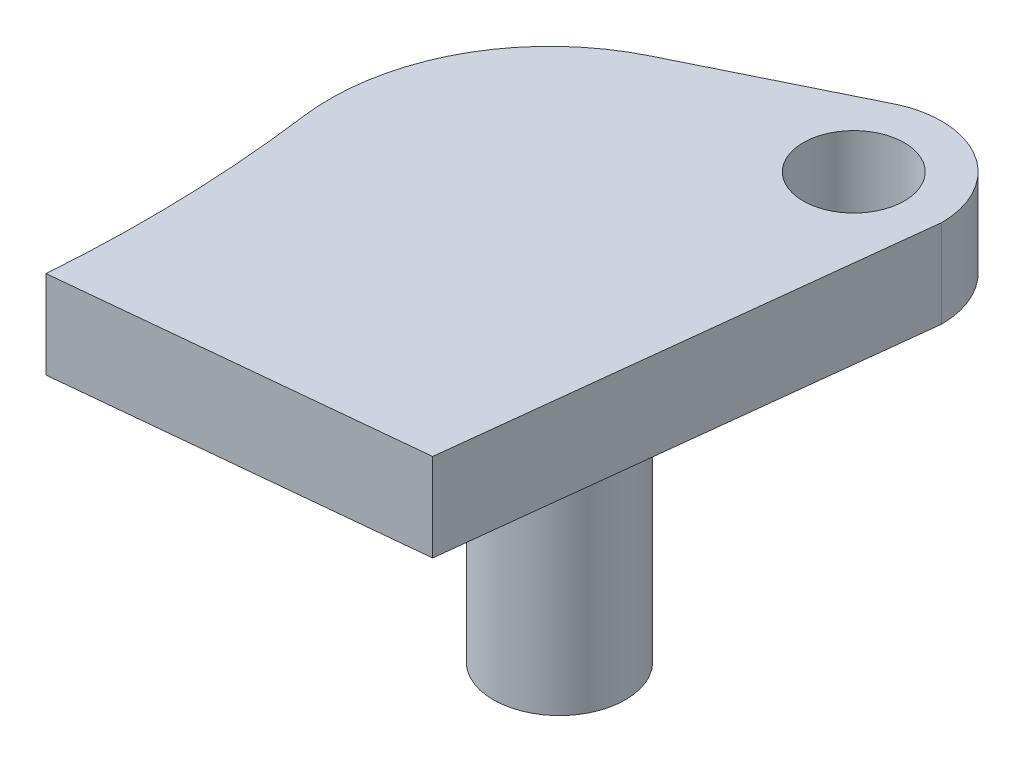
from build123d import *

# Parameters (mm, degrees)
SKETCH2_R           = 1.15
BOSS_EXTRUDE1_DEPTH = 2
SKETCH3_R           = 1.5
BOSS_EXTRUDE2_DEPTH = 5
FILLET1_R           = 5


with BuildPart() as part:
    # Sketch2 → Boss-Extrude1 (new body)
    with BuildSketch(Plane(origin=(0, 0, 0), x_dir=(1, 0, 0), z_dir=(0, 1, 0))):
        with BuildLine():
            Line((4.000381204, 4.673041052), (12.000381204, 5.468452872))
            Line((12.000381204, 5.468452872), (13.182938655, 15.86470146))
            ThreePointArc((13.182938655, 15.86470146), (12.256191848, 17.552341108), (10.334811071, 17.675966101))
            Line((10.334811071, 17.675966101), (3.154801126, 14.147870696))
            ThreePointArc((3.154801126, 14.147870696), (3.968738574, 9.44536378), (4.000381204, 4.673041052))
        make_face()
        with Locations(Location((11.182938655, 15.86470146, 0), (0, 0, 270))):
            Circle(SKETCH2_R, mode=Mode.SUBTRACT)
    extrude(amount=BOSS_EXTRUDE1_DEPTH)

    # Sketch3 → Boss-Extrude2 (add)
    with BuildSketch(Plane(origin=(0, 0, 0), x_dir=(1, 0, 0), z_dir=(0, 1, 0))):
        with Locations(Location((10.487550657, 9.86470146, 0), (0, 0, 270))):
            Circle(SKETCH3_R)
    extrude(amount=-BOSS_EXTRUDE2_DEPTH)

    # Fillet1
    fillet1_edges = [part.edges().sort_by_distance(p)[0] for p in [
        (3.154801126, 1, -14.147870696),
    ]]
    fillet(fillet1_edges, radius=FILLET1_R)


solid = part.part
